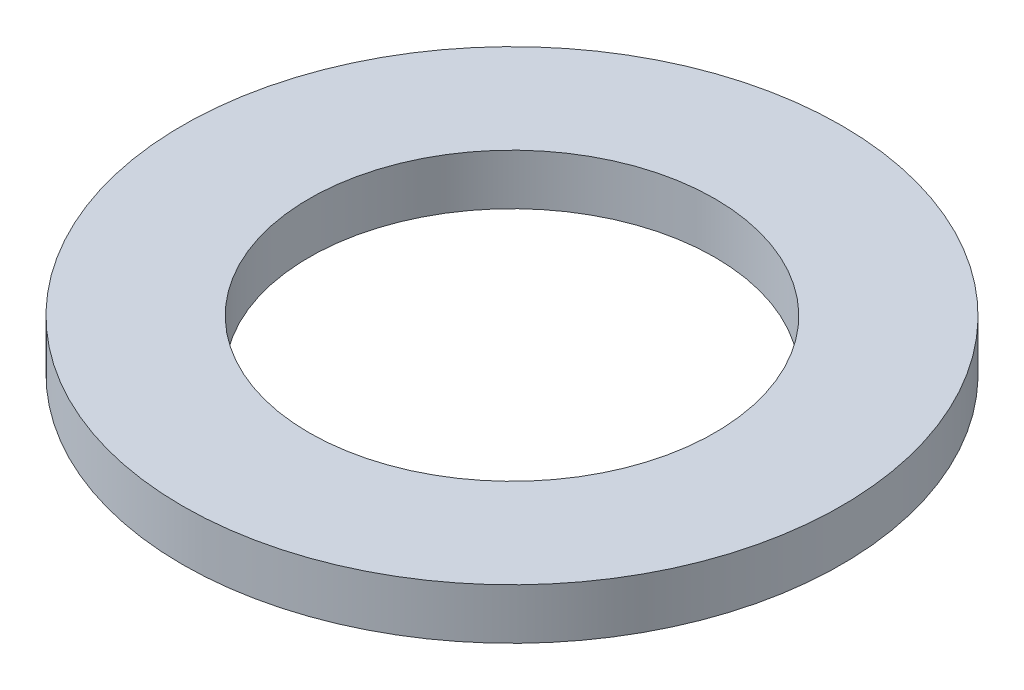
from build123d import *

# Parameters (mm, degrees)
SKETCH2_R           = 13
SKETCH2_R_2         = 8
BOSS_EXTRUDE1_DEPTH = 2


with BuildPart() as part:
    # Sketch2 → Boss-Extrude1 (new body)
    with BuildSketch(Plane(origin=(0, 0, 0), x_dir=(1, 0, 0), z_dir=(0, 1, 0))):
        with Locations(Location((0, 0, 0), (0, 0, 270))):
            Circle(SKETCH2_R)
        with Locations(Location((0, 0, 0), (0, 0, 270))):
            Circle(SKETCH2_R_2, mode=Mode.SUBTRACT)
    extrude(amount=BOSS_EXTRUDE1_DEPTH)


solid = part.part
